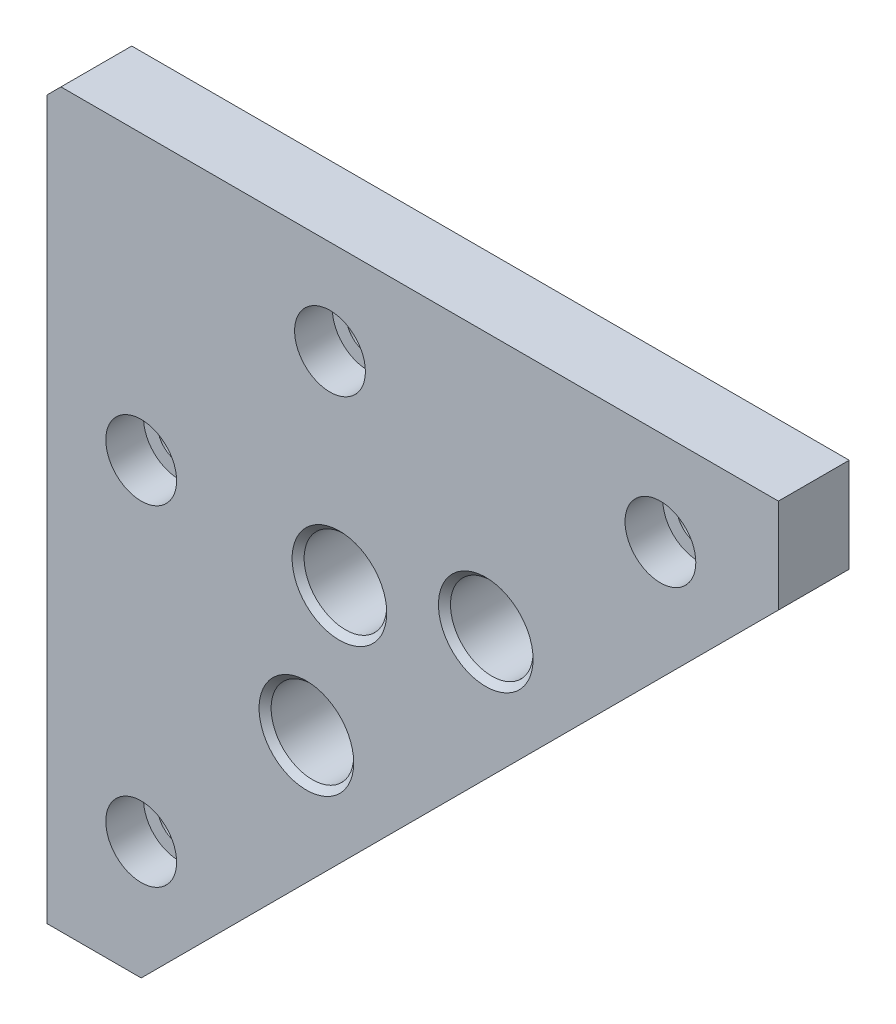
from build123d import *

# Parameters (mm, degrees)
EXTRUDE_1_DEPTH               = 15
HOLE_WIZARD_M20_1_D           = 17.5
HOLE_WIZARD_M20_1_CSINK_D     = 20.05
HOLE_WIZARD_M20_1_CSINK_ANGLE = 90
SKETCH_5_R                    = 4.5
CUT_EXTRUDE_1_DEPTH           = 220.715725427
SKETCH_6_R                    = 7.5
CUT_EXTRUDE_2_DEPTH           = 8


with BuildPart() as part:
    # 스케치1 → 보스-돌출1 (new body)
    with BuildSketch(Plane.XY):
        Polygon((155, 135), (20, 0), (0, 0), (0, 152), (3, 155), (155, 155), align=None)
    extrude(amount=EXTRUDE_1_DEPTH)

    # M20 나사 구멍1 (through all)
    with Locations(Plane.XY.offset(15)):
        with Locations((62, 93), (55, 62), (93, 100)):
            CounterSinkHole(HOLE_WIZARD_M20_1_D / 2, HOLE_WIZARD_M20_1_CSINK_D / 2, counter_sink_angle=HOLE_WIZARD_M20_1_CSINK_ANGLE)

    # 스케치5 → 컷-돌출1 (cut, through all)
    with BuildSketch(Plane.XY.offset(15)):
        with Locations((60, 135)):
            Circle(SKETCH_5_R)
        with Locations((20, 95)):
            Circle(SKETCH_5_R)
        with Locations((130, 135)):
            Circle(SKETCH_5_R)
        with Locations((20, 25)):
            Circle(SKETCH_5_R)
    extrude(amount=-CUT_EXTRUDE_1_DEPTH, mode=Mode.SUBTRACT)

    # 스케치6 → 컷-돌출2 (cut)
    with BuildSketch(Plane.XY.offset(15)):
        with Locations((20, 95)):
            Circle(SKETCH_6_R)
        with Locations((20, 25)):
            Circle(SKETCH_6_R)
        with Locations((60, 135)):
            Circle(SKETCH_6_R)
        with Locations((130, 135)):
            Circle(SKETCH_6_R)
    extrude(amount=-CUT_EXTRUDE_2_DEPTH, mode=Mode.SUBTRACT)


solid = part.part
